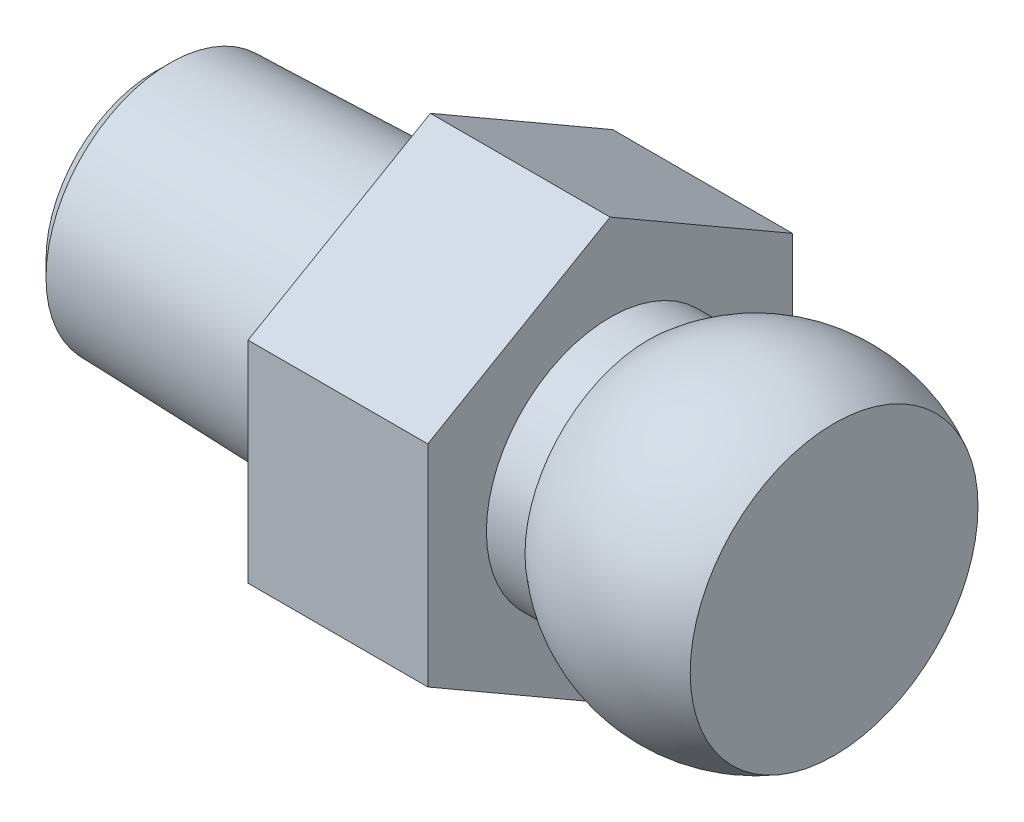
from build123d import *

# Parameters (mm, degrees)
SKETCH_2_R          = 14
CUT_EXTRUDE_1_DEPTH = 6.9


with BuildPart() as part:
    # 草图1 → 旋转1 (revolve)
    with BuildSketch(Plane.XY):
        with BuildLine():
            Line((0, 0), (0, 4.158121832))
            Line((0, 4.158121832), (0.59972308, 4.757844912))
            Line((0.59972308, 4.757844912), (10.6, 5.070048976))
            Line((10.6, 5.070048976), (10.6, 12))
            Line((10.6, 12), (17.5, 12))
            Line((17.5, 12), (17.5, 4.75))
            Line((17.5, 4.75), (18.982041495, 4.75))
            ThreePointArc((18.982041495, 4.75), (22.419985488, 6.249612989), (26.1, 5.524498371))
            Line((26.1, 5.524498371), (26.1, 0))
            Line((26.1, 0), (0, 0))
        make_face()
    revolve(axis=Axis((26.1, 0, 0), (-1, 0, 0)))

    # 草图2 → 切除-拉伸1 (cut)
    with BuildSketch(Plane.ZY.offset(-10.6)):
        Circle(SKETCH_2_R)
        Polygon((0, -8.082903769), (7, -4.041451884), (7, 4.041451884), (0, 8.082903769), (-7, 4.041451884), (-7, -4.041451884), align=None, mode=Mode.SUBTRACT)
    extrude(amount=-CUT_EXTRUDE_1_DEPTH, mode=Mode.SUBTRACT)


solid = part.part
